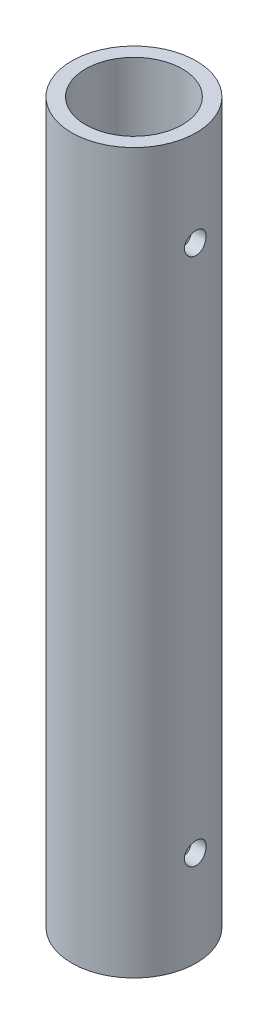
from build123d import *

# Parameters (mm, degrees)
SKETCH1_R           = 14.2875
SKETCH1_R_2         = 11.1125
BOSS_EXTRUDE1_DEPTH = 82.55
SKETCH2_R           = 2.4892
CUT_EXTRUDE1_DEPTH  = 85.986868471


with BuildPart() as part:
    # Sketch1 → Boss-Extrude1 (new, symmetric)
    with BuildSketch(Plane(origin=(0, 0, 0), x_dir=(1, 0, 0), z_dir=(0, 1, 0))):
        with Locations(Location((0, 0, 0), (0, 0, 270))):
            Circle(SKETCH1_R)
        with Locations(Location((0, 0, 0), (0, 0, 270))):
            Circle(SKETCH1_R_2, mode=Mode.SUBTRACT)
    extrude(amount=BOSS_EXTRUDE1_DEPTH, both=True)

    # Sketch2 → Cut-Extrude1 (cut, symmetric)
    with BuildSketch(Plane(origin=(0, 0, 0), x_dir=(0, 0, -1), z_dir=(1, 0, 0))):
        with Locations((0, 60.6425)):
            Circle(SKETCH2_R)
    cut_extrude1 = extrude(amount=CUT_EXTRUDE1_DEPTH, both=True, mode=Mode.SUBTRACT)

    # Mirror1: Cut-Extrude1 across plane
    add(cut_extrude1.mirror(Plane.ZX), mode=Mode.SUBTRACT)


solid = part.part
